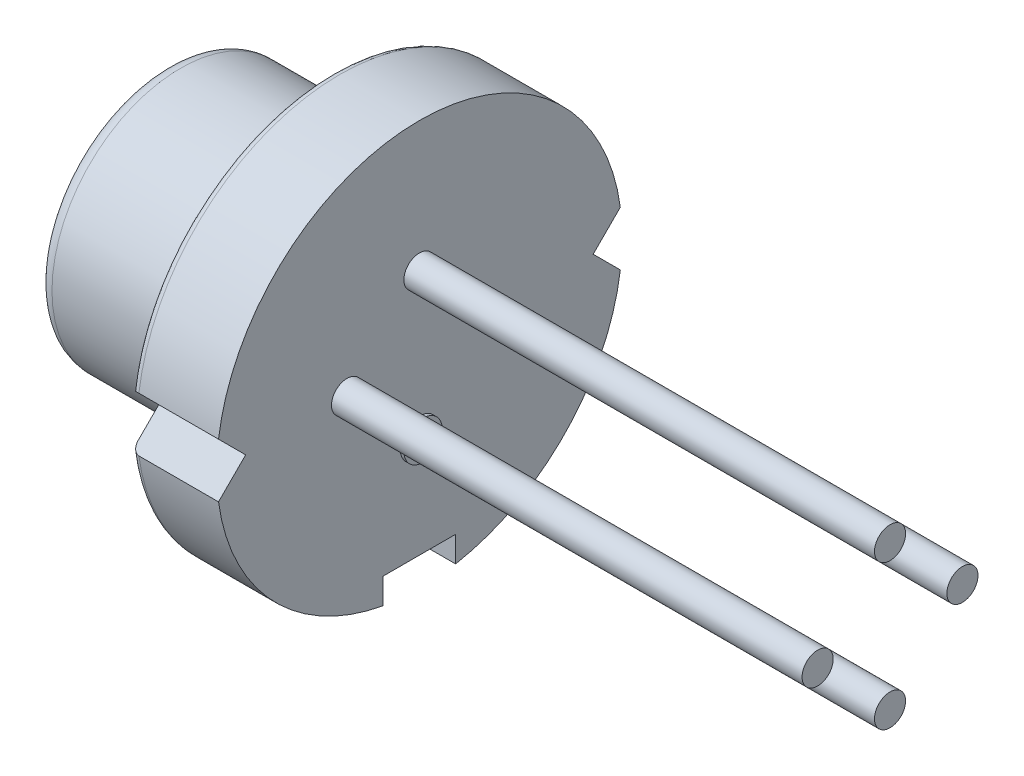
from build123d import *

# Parameters (mm, degrees)
SKETCH6_R           = 0.215
EXTRUDE2_DEPTH      = 6.5
CUT_EXTRUDE1_DEPTH  = 8.611175993
FILLET1_R           = 0.2
FILLET2_R           = 0.1
SKETCH6_3_R         = 0.265
SKETCH6_3_R_2       = 0.215
BOSS_EXTRUDE2_DEPTH = 0.05


with BuildPart() as part:
    # Sketch4 → Revolve2 (revolve)
    with BuildSketch(Plane.XY, mode=Mode.PRIVATE) as revolve2_sk:
        with BuildLine():
            Line((0, 0), (0, 0.7))
            Line((0, 0.7), (-0.75, 0.7))
            Line((-0.75, 0.7), (-0.75, 0.8))
            Line((-0.75, 0.8), (-1, 0.8))
            Line((-1, 0.8), (-1, 1.775))
            Line((-1, 1.775), (0.75, 1.775))
            ThreePointArc((0.75, 1.775), (0.926776695, 1.848223305), (1, 2.025))
            Line((1, 2.025), (1, 2.1))
            Line((1, 2.1), (1.3, 2.1))
            Line((1.3, 2.1), (1.3, 2.8))
            Line((1.3, 2.8), (2.5, 2.8))
            Line((2.5, 2.8), (2.5, 0))
            Line((2.5, 0), (0, 0))
        make_face()
    revolve(revolve2_sk.sketch.rotate(Axis((-2.49171246, 0, 0), (1, 0, 0)), 90), axis=Axis((-2.49171246, 0, 0), (1, 0, 0)))

    # Sketch6 → Extrude2 (add)
    with BuildSketch(Plane(origin=(2.5, 0, 0), x_dir=(0, 0, -1), z_dir=(1, 0, 0))):
        with Locations(Location((0, -1, 0), (0, 0, 180))):
            Circle(SKETCH6_R)
        with Locations(Location((-1, 0, 0), (0, 0, 180))):
            Circle(SKETCH6_R)
        with Locations(Location((1, 0, 0), (0, 0, 180))):
            Circle(SKETCH6_R)
        with Locations(Location((0, 1, 0), (0, 0, 180))):
            Circle(SKETCH6_R)
    extrude(amount=EXTRUDE2_DEPTH)

    # Sketch8 → Cut-Extrude1 (cut, through all)
    with BuildSketch(Plane(origin=(2.5, 0, 0), x_dir=(0, 0, -1), z_dir=(1, 0, 0))):
        with BuildLine():
            Line((-2.4, 0), (-2.774801575, 0.374801575))
            ThreePointArc((-2.774801575, 0.374801575), (-2.8, 0), (-2.774801575, -0.374801575))
            Line((-2.774801575, -0.374801575), (-2.4, 0))
        make_face()
        with BuildLine():
            Line((2.774801575, 0.374801575), (2.4, 0))
            Line((2.4, 0), (2.774801575, -0.374801575))
            ThreePointArc((2.774801575, -0.374801575), (2.793693291, -0.187823841), (2.8, 0))
            ThreePointArc((2.8, 0), (2.793693291, 0.187823841), (2.774801575, 0.374801575))
        make_face()
        with BuildLine():
            ThreePointArc((-0.5, -2.754995463), (0, -2.8), (0.5, -2.754995463))
            Line((0.5, -2.754995463), (0.5, -2.4))
            Line((0.5, -2.4), (-0.5, -2.4))
            Line((-0.5, -2.4), (-0.5, -2.754995463))
        make_face()
    extrude(amount=-CUT_EXTRUDE1_DEPTH, mode=Mode.SUBTRACT)

    # Fillet1
    fillet1_edges = [part.edges().sort_by_distance(p)[0] for p in [
        (-1, 0, -1.775),
    ]]
    fillet(fillet1_edges, radius=FILLET1_R)

    # Fillet2
    fillet2_edges = [part.edges().sort_by_distance(p)[0] for p in [
        (1.3, 2.8, 0),
        (1.3, -1.934576937, -2.02420653),
        (1.3, -1.934576937, 2.02420653),
    ]]
    fillet(fillet2_edges, radius=FILLET2_R)

    # Sketch6<3> → Boss-Extrude2 (add)
    with BuildSketch(Plane(origin=(2.5, 0, 0), x_dir=(0, 0, -1), z_dir=(1, 0, 0))):
        with Locations(Location((0, -1, 0), (0, 0, 180))):
            Circle(SKETCH6_3_R)
        with Locations((0, -1)):
            Circle(SKETCH6_3_R_2, mode=Mode.SUBTRACT)
    extrude(amount=BOSS_EXTRUDE2_DEPTH)


solid = part.part
